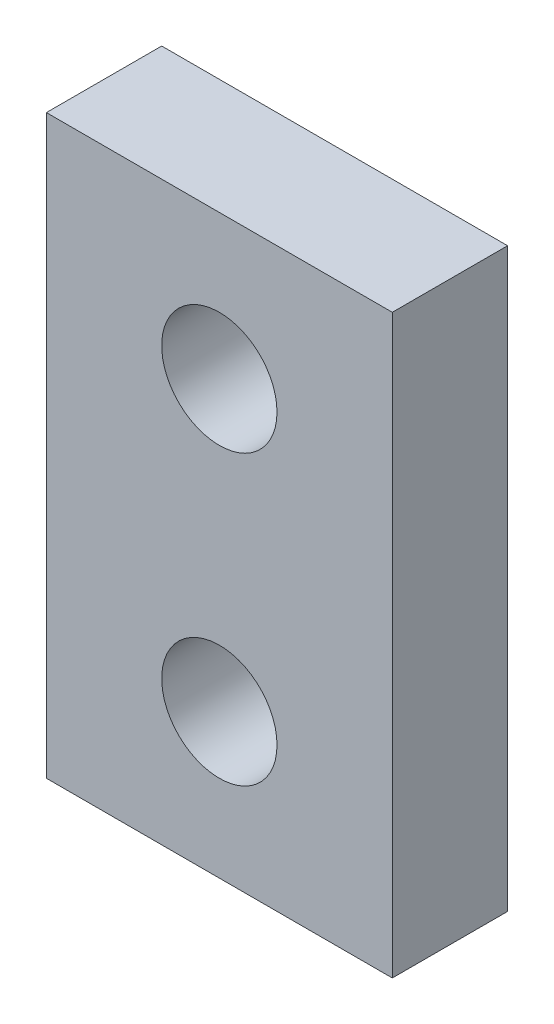
from build123d import *

# Parameters (mm, degrees)
CROQUIS1_W              = 30
CROQUIS1_H              = 50
CROQUIS1_R              = 5
SALIENTE_EXTRUIR1_DEPTH = 10


with BuildPart() as part:
    # Croquis1 → Saliente-Extruir1 (new body)
    with BuildSketch(Plane.XY):
        Rectangle(CROQUIS1_W, CROQUIS1_H)
        with Locations((0, 12.5)):
            Circle(CROQUIS1_R, mode=Mode.SUBTRACT)
        with Locations((0, -12.5)):
            Circle(CROQUIS1_R, mode=Mode.SUBTRACT)
    extrude(amount=SALIENTE_EXTRUIR1_DEPTH)


solid = part.part
